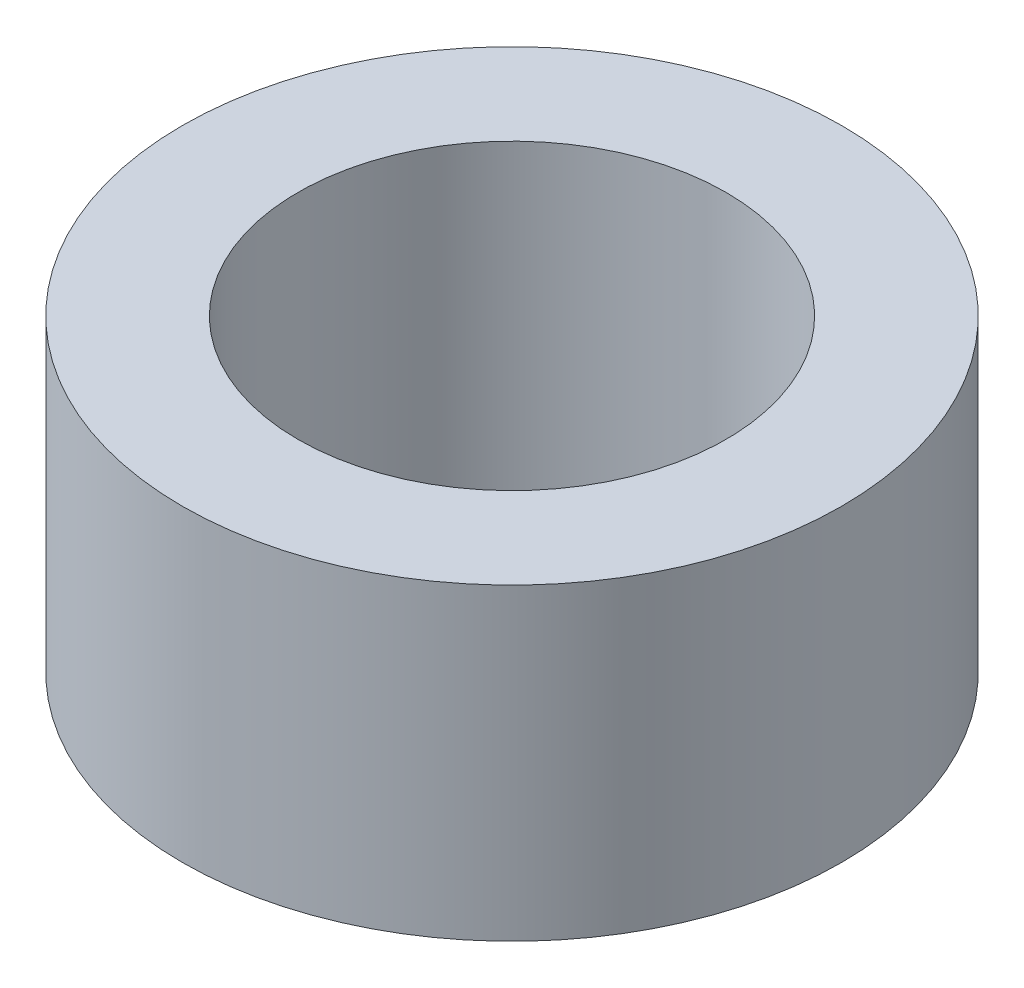
from build123d import *

# Parameters (mm, degrees)
SKETCH1_R           = 4.275
SKETCH1_R_2         = 2.775
BOSS_EXTRUDE1_DEPTH = 4


with BuildPart() as part:
    # Sketch1 → Boss-Extrude1 (new body)
    with BuildSketch(Plane(origin=(0, 0, 0), x_dir=(1, 0, 0), z_dir=(0, 1, 0))):
        with Locations(Location((0, 0, 0), (0, 0, 270))):
            Circle(SKETCH1_R)
        with Locations(Location((0, 0, 0), (0, 0, 270))):
            Circle(SKETCH1_R_2, mode=Mode.SUBTRACT)
    extrude(amount=BOSS_EXTRUDE1_DEPTH)


solid = part.part
